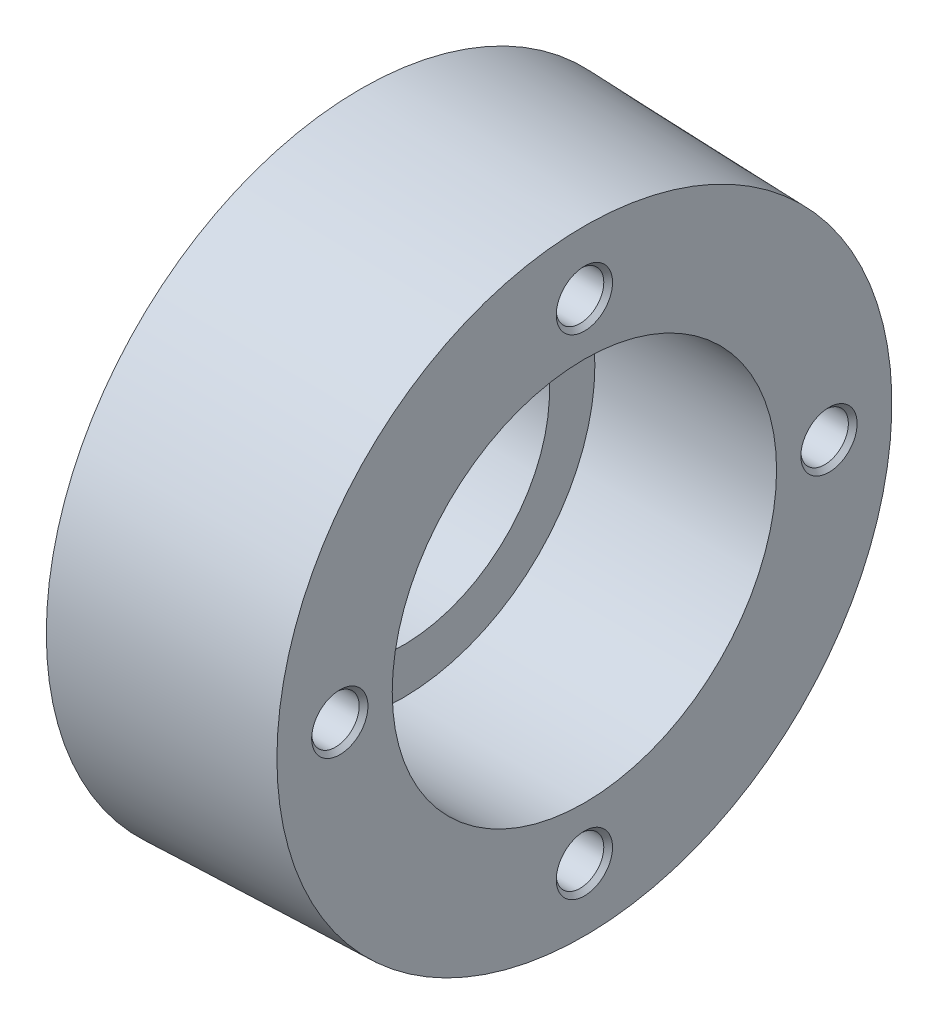
from build123d import *

# Parameters (mm, degrees)
CIRPATTERN1_COUNT = 4


with BuildPart() as part:
    # Sketch1 → Revolve1 (revolve)
    with BuildSketch(Plane.XY, mode=Mode.PRIVATE) as revolve1_sk:
        Polygon((0, 21), (11, 21), (11, 27.5), (37, 27.5), (37, 44), (5, 45), (5, 28), (0, 28), align=None)
    revolve(revolve1_sk.sketch.rotate(Axis((0, 0, 0), (1, 0, 0)), 90), axis=Axis((0, 0, 0), (1, 0, 0)))

    # Sketch4 → M8 Tapped Hole1 (revolve, cut)
    with BuildSketch(Plane(origin=(37, 35, 0), x_dir=(0, 0, -1), z_dir=(0, 1, 0))):
        Polygon((0, 0), (0, 24.292926105), (3.4, 22.25), (3.4, 0.625), (4.025, 0), align=None)
    m8_tapped_hole1 = revolve(axis=Axis((43.35, 35, 0), (-1, 0, 0)), mode=Mode.SUBTRACT)

    # CirPattern1: M8 Tapped Hole1 ×4 about axis
    cirpattern1_axis = Axis((0, 0, 0), (1, 0, 0))
    for i in range(1, CIRPATTERN1_COUNT):
        add(m8_tapped_hole1.rotate(cirpattern1_axis, i * 360 / CIRPATTERN1_COUNT), mode=Mode.SUBTRACT)


solid = part.part
